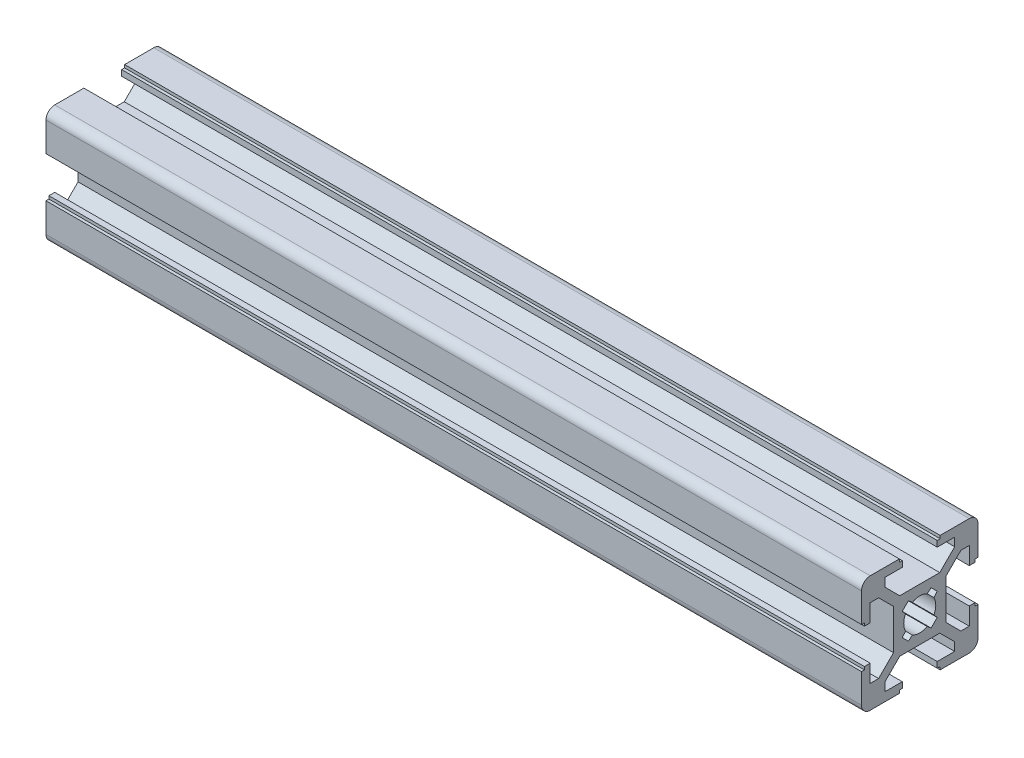
from build123d import *

# Parameters (mm, degrees)
BR_EXTRUDE_DEPTH      = 70
BR_EXTRUDE_DEPTH_BACK = 70


with BuildPart() as part:
    # Sketch2 → BR_Extrude (new, two sides: drawn at the far end of the back side and taken through both)
    with BuildSketch(Plane(origin=(0, 0, 0), x_dir=(0, 0, -1), z_dir=(1, 0, 0)).offset(-BR_EXTRUDE_DEPTH_BACK)):
        with BuildLine():
            Line((-7.060660172, -6), (-8.5, -6))
            Line((-8.5, -6), (-8.5, -3))
            Line((-8.5, -3), (-9.5, -3))
            Line((-9.5, -3), (-9.5, -3.5))
            Line((-9.5, -3.5), (-10, -3.5))
            Line((-10, -3.5), (-10, -8.5))
            ThreePointArc((-10, -8.5), (-9.560660172, -9.560660172), (-8.5, -10))
            Line((-8.5, -10), (-3.5, -10))
            Line((-3.5, -10), (-3.5, -9.5))
            Line((-3.5, -9.5), (-3, -9.5))
            Line((-3, -9.5), (-3, -8.5))
            Line((-3, -8.5), (-6, -8.5))
            Line((-6, -8.5), (-6, -7.060660172))
            Line((-6, -7.060660172), (-3.439339828, -4.5))
            Line((-3.439339828, -4.5), (3.439339828, -4.5))
            Line((3.439339828, -4.5), (6, -7.060660172))
            Line((6, -7.060660172), (6, -8.5))
            Line((6, -8.5), (3, -8.5))
            Line((3, -8.5), (3, -9.5))
            Line((3, -9.5), (3.5, -9.5))
            Line((3.5, -9.5), (3.5, -10))
            Line((3.5, -10), (8.5, -10))
            ThreePointArc((8.5, -10), (9.560660172, -9.560660172), (10, -8.5))
            Line((10, -8.5), (10, -3.5))
            Line((10, -3.5), (9.5, -3.5))
            Line((9.5, -3.5), (9.5, -3))
            Line((9.5, -3), (8.5, -3))
            Line((8.5, -3), (8.5, -6))
            Line((8.5, -6), (7.060660172, -6))
            Line((7.060660172, -6), (4.5, -3.439339828))
            Line((4.5, -3.439339828), (4.5, 3.439339828))
            Line((4.5, 3.439339828), (7.060660172, 6))
            Line((7.060660172, 6), (8.5, 6))
            Line((8.5, 6), (8.5, 3))
            Line((8.5, 3), (9.5, 3))
            Line((9.5, 3), (9.5, 3.5))
            Line((9.5, 3.5), (10, 3.5))
            Line((10, 3.5), (10, 8.5))
            ThreePointArc((10, 8.5), (9.560660172, 9.560660172), (8.5, 10))
            Line((8.5, 10), (3.5, 10))
            Line((3.5, 10), (3.5, 9.5))
            Line((3.5, 9.5), (3, 9.5))
            Line((3, 9.5), (3, 8.5))
            Line((3, 8.5), (6, 8.5))
            Line((6, 8.5), (6, 7.060660172))
            Line((6, 7.060660172), (3.439339828, 4.5))
            Line((3.439339828, 4.5), (-3.439339828, 4.5))
            Line((-3.439339828, 4.5), (-6, 7.060660172))
            Line((-6, 7.060660172), (-6, 8.5))
            Line((-6, 8.5), (-3, 8.5))
            Line((-3, 8.5), (-3, 9.5))
            Line((-3, 9.5), (-3.5, 9.5))
            Line((-3.5, 9.5), (-3.5, 10))
            Line((-3.5, 10), (-8.5, 10))
            ThreePointArc((-8.5, 10), (-9.560660172, 9.560660172), (-10, 8.5))
            Line((-10, 8.5), (-10, 3.5))
            Line((-10, 3.5), (-9.5, 3.5))
            Line((-9.5, 3.5), (-9.5, 3))
            Line((-9.5, 3), (-8.5, 3))
            Line((-8.5, 3), (-8.5, 6))
            Line((-8.5, 6), (-7.060660172, 6))
            Line((-7.060660172, 6), (-4.5, 3.439339828))
            Line((-4.5, 3.439339828), (-4.5, -3.439339828))
            Line((-4.5, -3.439339828), (-7.060660172, -6))
        make_face()
        with BuildLine():
            Line((-3.000174203, -1.949573265), (-2.435636363, -1.276783266))
            ThreePointArc((-2.435636363, -1.276783266), (-2.75, 0), (-2.435636363, 1.276783266))
            Line((-2.435636363, 1.276783266), (-3.000174203, 1.949573265))
            Line((-3.000174203, 1.949573265), (-1.949573265, 3.000174203))
            Line((-1.949573265, 3.000174203), (-1.276783266, 2.435636363))
            ThreePointArc((-1.276783266, 2.435636363), (0, 2.75), (1.276783266, 2.435636363))
            Line((1.276783266, 2.435636363), (1.949573265, 3.000174203))
            Line((1.949573265, 3.000174203), (3.000174203, 1.949573265))
            Line((3.000174203, 1.949573265), (2.435636363, 1.276783266))
            ThreePointArc((2.435636363, 1.276783266), (2.75, 0), (2.435636363, -1.276783266))
            Line((2.435636363, -1.276783266), (3.000174203, -1.949573265))
            Line((3.000174203, -1.949573265), (1.949573265, -3.000174203))
            Line((1.949573265, -3.000174203), (1.276783266, -2.435636363))
            ThreePointArc((1.276783266, -2.435636363), (0, -2.75), (-1.276783266, -2.435636363))
            Line((-1.276783266, -2.435636363), (-1.949573265, -3.000174203))
            Line((-1.949573265, -3.000174203), (-3.000174203, -1.949573265))
        make_face(mode=Mode.SUBTRACT)
    extrude(amount=BR_EXTRUDE_DEPTH + BR_EXTRUDE_DEPTH_BACK)


solid = part.part
